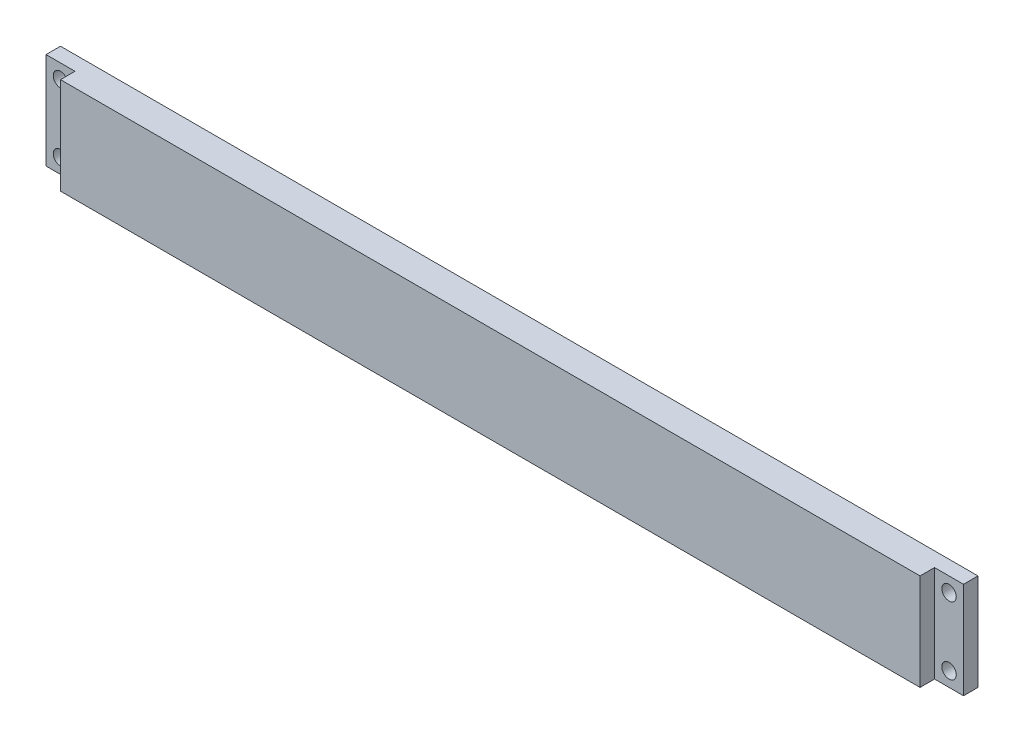
from build123d import *

# Parameters (mm, degrees)
ESQUISSE1_W             = 190
ESQUISSE1_H             = 20
BOSS_EXTRU_1_DEPTH      = 6
ESQUISSE2_W             = 6
ESQUISSE2_H             = 20
ENL_V_MAT_EXTRU_1_DEPTH = 3
ESQUISSE3_R             = 1.5
ENL_V_MAT_EXTRU_2_DEPTH = 6


with BuildPart() as part:
    # Esquisse1 → Boss.-Extru.1 (new body)
    with BuildSketch(Plane.XY):
        Rectangle(ESQUISSE1_W, ESQUISSE1_H)
    extrude(amount=BOSS_EXTRU_1_DEPTH)

    # Esquisse2 → Enlèv. mat.-Extru.1 (cut)
    with BuildSketch(Plane.XY.offset(6)):
        with Locations((-92, 0)):
            Rectangle(ESQUISSE2_W, ESQUISSE2_H)
        with Locations((92, 0)):
            Rectangle(ESQUISSE2_W, ESQUISSE2_H)
    extrude(amount=-ENL_V_MAT_EXTRU_1_DEPTH, mode=Mode.SUBTRACT)

    # Esquisse3 → Enlèv. mat.-Extru.2 (cut)
    with BuildSketch(Plane(origin=(0, 0, 0), x_dir=(-1, 0, 0), z_dir=(0, 0, -1))):
        with Locations((-92, -7)):
            Circle(ESQUISSE3_R)
        with Locations((-92, 7)):
            Circle(ESQUISSE3_R)
        with Locations(Location((92, 7, 0), (0, 0, 180))):
            Circle(ESQUISSE3_R)
        with Locations(Location((92, -7, 0), (0, 0, 180))):
            Circle(ESQUISSE3_R)
    extrude(amount=-ENL_V_MAT_EXTRU_2_DEPTH, mode=Mode.SUBTRACT)


solid = part.part
